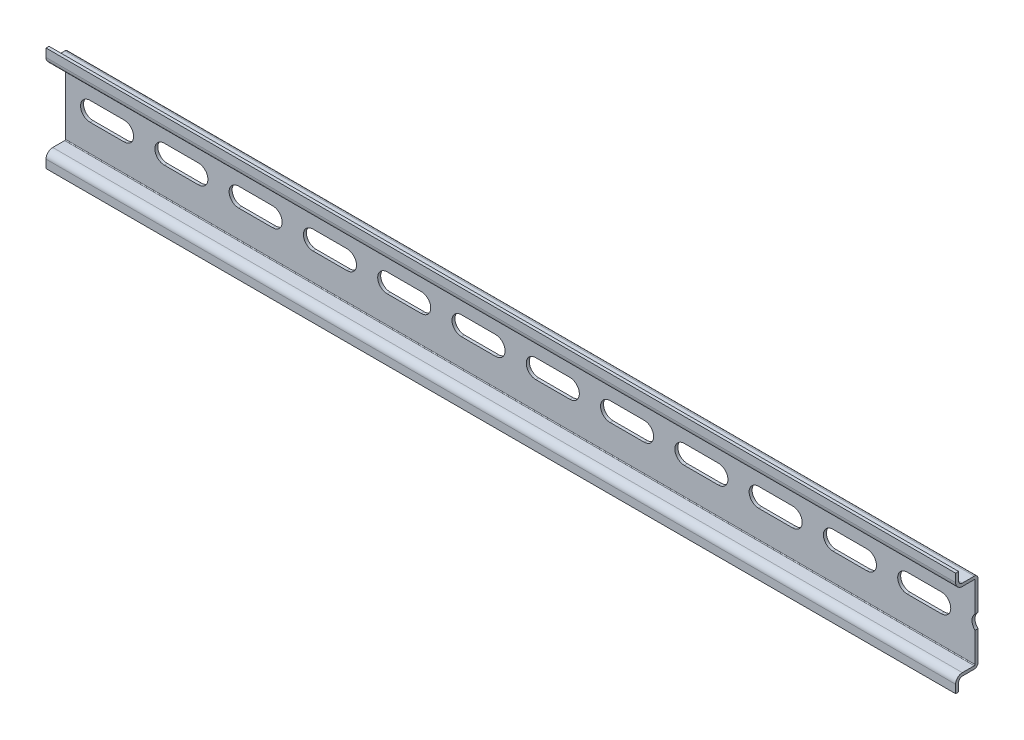
from build123d import *

# Parameters (mm, degrees)
STRUCTURAL_MEMBER1_DEPTH = 304.8
CUT_EXTRUDE1_REACH       = 155.585
LPATTERN1_COUNT          = 13
LPATTERN1_PITCH          = 24.892


with BuildPart() as part:
    # Sketch2 → Structural Member1 (new body)
    with BuildSketch(Plane(origin=(-152.4, 0, 0), x_dir=(0, 0, -1), z_dir=(1, 0, 0))):
        with BuildLine():
            Line((0, 12.25), (0, -12.25))
            ThreePointArc((0, -12.25), (-0.366116524, -13.133883476), (-1.25, -13.5))
            Line((-1.25, -13.5), (-5.25, -13.5))
            ThreePointArc((-5.25, -13.5), (-6.133883476, -13.866116524), (-6.5, -14.75))
            Line((-6.5, -14.75), (-6.5, -17.5))
            Line((-6.5, -17.5), (-7.5, -17.5))
            Line((-7.5, -17.5), (-7.5, -14.75))
            ThreePointArc((-7.5, -14.75), (-6.840990258, -13.159009742), (-5.25, -12.5))
            Line((-5.25, -12.5), (-1.25, -12.5))
            ThreePointArc((-1.25, -12.5), (-1.073223305, -12.426776695), (-1, -12.25))
            Line((-1, -12.25), (-1, 12.25))
            ThreePointArc((-1, 12.25), (-1.073223305, 12.426776695), (-1.25, 12.5))
            Line((-1.25, 12.5), (-5.25, 12.5))
            ThreePointArc((-5.25, 12.5), (-6.840990258, 13.159009742), (-7.5, 14.75))
            Line((-7.5, 14.75), (-7.5, 17.5))
            Line((-7.5, 17.5), (-6.5, 17.5))
            Line((-6.5, 17.5), (-6.5, 14.75))
            ThreePointArc((-6.5, 14.75), (-6.133883476, 13.866116524), (-5.25, 13.5))
            Line((-5.25, 13.5), (-1.25, 13.5))
            ThreePointArc((-1.25, 13.5), (-0.366116524, 13.133883476), (0, 12.25))
        make_face()
    extrude(amount=STRUCTURAL_MEMBER1_DEPTH)

    # Sketch3 → Cut-Extrude1 (cut, up to next)
    with BuildSketch(Plane.XY, mode=Mode.PRIVATE) as cut_extrude1_sk1:
        with BuildLine():
            Line((-144.145, 3.175), (-132.715, 3.175))
            ThreePointArc((-132.715, 3.175), (-129.54, 0), (-132.715, -3.175))
            Line((-132.715, -3.175), (-144.145, -3.175))
            ThreePointArc((-144.145, -3.175), (-147.32, 0), (-144.145, 3.175))
        make_face()
    cut_extrude1_tool1 = extrude(cut_extrude1_sk1.sketch, amount=CUT_EXTRUDE1_REACH, mode=Mode.PRIVATE) & part.part
    cut_extrude1 = cut_extrude1_tool1.solids().sort_by_distance((-138.43, 0, 0))[0]
    add(cut_extrude1, mode=Mode.SUBTRACT)

    # LPattern1: Cut-Extrude1 ×13
    with Locations(*[(i * LPATTERN1_PITCH, 0, 0) for i in range(1, LPATTERN1_COUNT)]):
        add(cut_extrude1, mode=Mode.SUBTRACT)


solid = part.part
